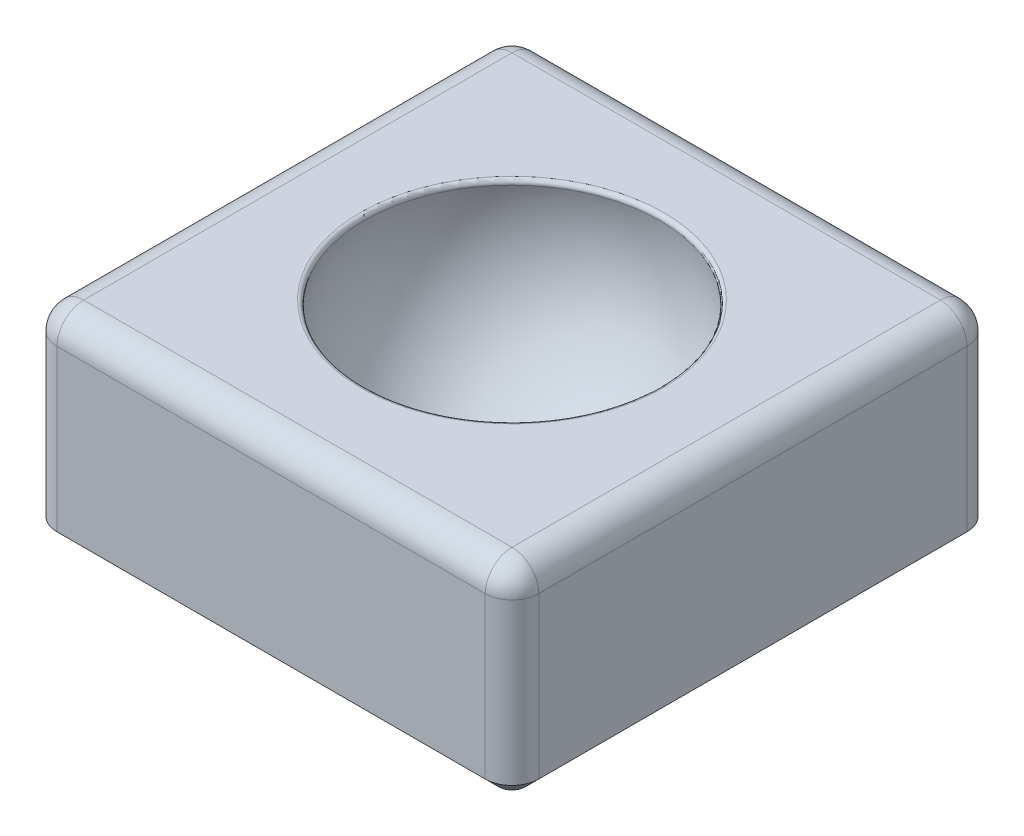
from build123d import *

# Parameters (mm, degrees)
SKETCH_1_W          = 36
SKETCH_1_H          = 36
EXTRUDE_1_DEPTH     = 15
FILLET_1_R          = 0.3
FILLET_2_R          = 2
SKETCH_5_R          = 3
CUT_EXTRUDE_1_DEPTH = 10
CHAMFER_1_SIZE      = 1


with BuildPart() as part:
    # Эскиз1 → Бобышка-Вытянуть1 (new body)
    with BuildSketch(Plane(origin=(0, 0, 0), x_dir=(1, 0, 0), z_dir=(0, 1, 0))):
        Rectangle(SKETCH_1_W, SKETCH_1_H)
    extrude(amount=EXTRUDE_1_DEPTH)

    # Эскиз4 → Вырез-Повернуть2 (revolve, cut)
    with BuildSketch(Plane(origin=(0, 12, 0), x_dir=(1, 0, 0), z_dir=(0, 1, 0))):
        with BuildLine():
            Line((-11.35, 0), (11.35, 0))
            ThreePointArc((11.35, 0), (0, 11.35), (-11.35, 0))
        make_face()
    revolve(axis=Axis((-23.513868144, 12, 0), (1, 0, 0)), mode=Mode.SUBTRACT)

    # Скругление1
    fillet_1_edges = [part.edges().sort_by_distance(p)[0] for p in [
        (0, 15, -10.946346422),
    ]]
    fillet(fillet_1_edges, radius=FILLET_1_R)

    # Скругление2
    fillet_2_edges = [part.edges().sort_by_distance(p)[0] for p in [
        (-18, 15, 0),
        (0, 15, 18),
        (18, 15, 0),
        (18, 7.5, 18),
        (-18, 7.5, 18),
        (-18, 7.5, -18),
        (18, 7.5, -18),
        (0, 15, -18),
    ]]
    fillet(fillet_2_edges, radius=FILLET_2_R)

    # Эскиз5 → Вырез-Вытянуть1 (cut)
    with BuildSketch(Plane.XZ):
        with Locations(Location((0, 0, 0), (0, 0, 270))):
            Circle(SKETCH_5_R)
    extrude(amount=-CUT_EXTRUDE_1_DEPTH, mode=Mode.SUBTRACT)

    # Фаска1
    chamfer_1_edges = [part.edges().sort_by_distance(p)[0] for p in [
        (0, 0, -18),
        (18, 0, 0),
        (0, 0, 18),
        (-18, 0, 0),
        (17.414213562, 0, 17.414213562),
        (17.414213562, 0, -17.414213562),
        (-17.414213562, 0, 17.414213562),
        (-17.414213562, 0, -17.414213562),
        (0, 0, 3),
    ]]
    chamfer(chamfer_1_edges, length=CHAMFER_1_SIZE)


solid = part.part
